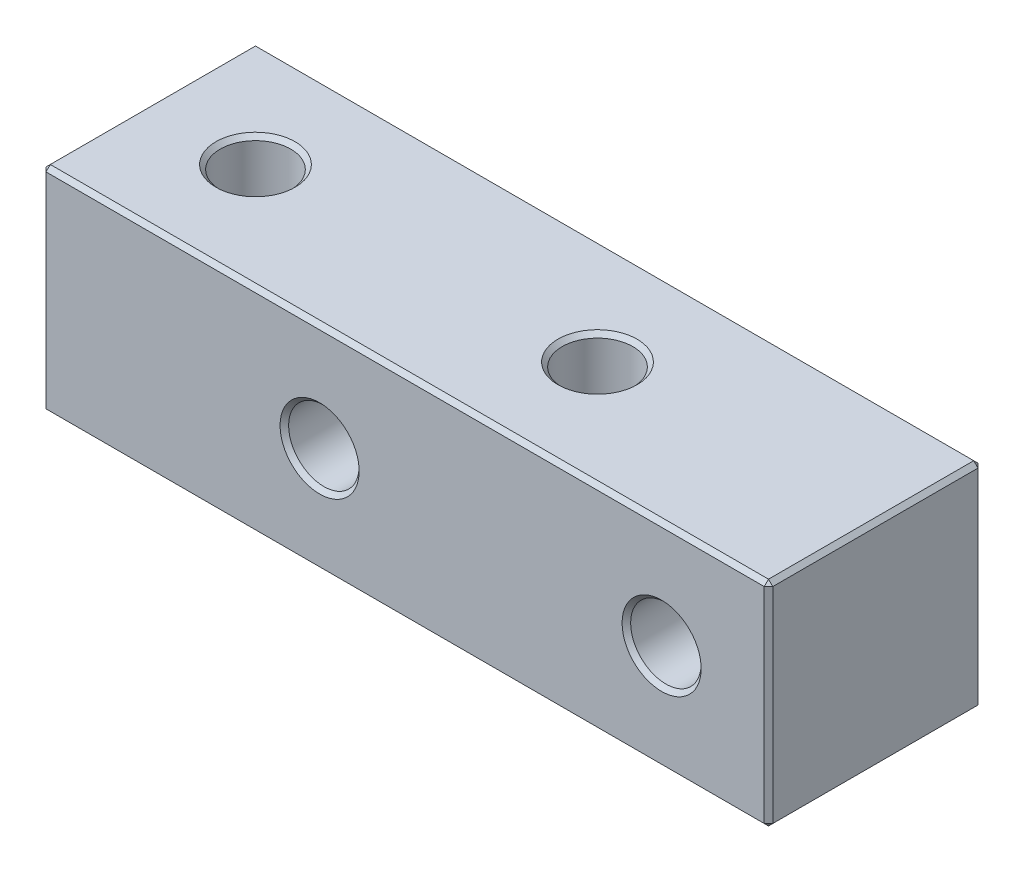
from build123d import *

# Parameters (mm, degrees)
SKETCH_1_W         = 34
SKETCH_1_H         = 10
EXTRUDE_1_DEPTH    = 5
HOLE_WIZARD_M4_1_D = 3.3
HOLE_WIZARD_M4_2_D = 3.3
CHAMFER_1_SIZE     = 0.2


with BuildPart() as part:
    # 草图1 → 凸台-拉伸1 (new, symmetric)
    with BuildSketch(Plane(origin=(0, 0, 0), x_dir=(1, 0, 0), z_dir=(0, 1, 0))):
        Rectangle(SKETCH_1_W, SKETCH_1_H)
    extrude(amount=EXTRUDE_1_DEPTH, both=True)

    # M4 螺纹孔1 (through all)
    with Locations(Plane(origin=(0, 5, 0), x_dir=(1, 0, 0), z_dir=(0, 1, 0))):
        with Locations((-12, 0), (4, 0)):
            Hole(HOLE_WIZARD_M4_1_D / 2)

    # M4 螺纹孔2 (through all)
    with Locations(Plane(origin=(0, 0, -5), x_dir=(-1, 0, 0), z_dir=(0, 0, -1))):
        with Locations((-12, 0), (4, 0)):
            Hole(HOLE_WIZARD_M4_2_D / 2)

    # 倒角1
    chamfer_1_edges = [part.edges().sort_by_distance(p)[0] for p in [
        (5.65, -5, 0),
        (-10.35, -5, 0),
        (-5.65, 0, 5),
        (10.35, 0, 5),
        (5.65, 5, 0),
        (-10.35, 5, 0),
        (-17, -5, 0),
        (17, -5, 0),
        (-17, 0, 5),
        (0, -5, 5),
        (17, 0, 5),
        (0, 5, 5),
        (-17, 5, 0),
        (17, 5, 0),
        (17, 0, -5),
        (0, 5, -5),
        (-17, 0, -5),
        (0, -5, -5),
        (-5.65, 0, -5),
        (10.35, 0, -5),
    ]]
    chamfer(chamfer_1_edges, length=CHAMFER_1_SIZE)


solid = part.part
